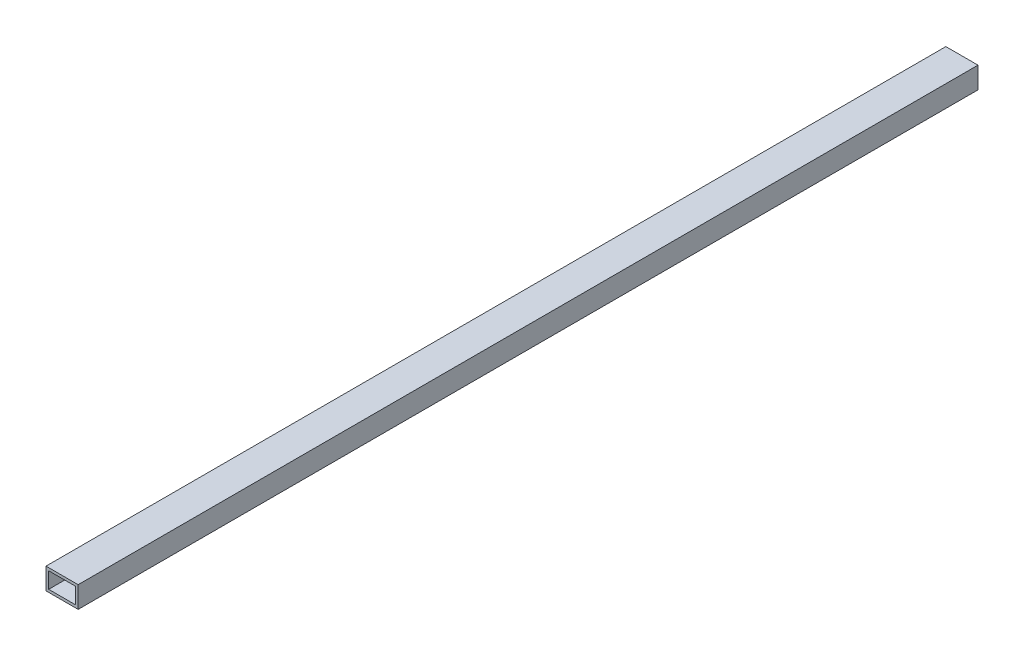
from build123d import *

# Parameters (mm, degrees)
SKETCH1_W           = 38.1
SKETCH1_H           = 25.4
BOSS_EXTRUDE1_DEPTH = 1066.8
SHELL1_T            = -3.175


with BuildPart() as part:
    # Sketch1 → Boss-Extrude1 (new body)
    with BuildSketch(Plane.XY):
        Rectangle(SKETCH1_W, SKETCH1_H)
    extrude(amount=BOSS_EXTRUDE1_DEPTH)

    # Shell1
    shell1_openings = [part.faces().sort_by_distance(p)[0] for p in [
        (0, 0, 1066.8),
        (0, 0, 0),
    ]]
    offset(amount=SHELL1_T, openings=shell1_openings, kind=Kind.INTERSECTION)


solid = part.part
